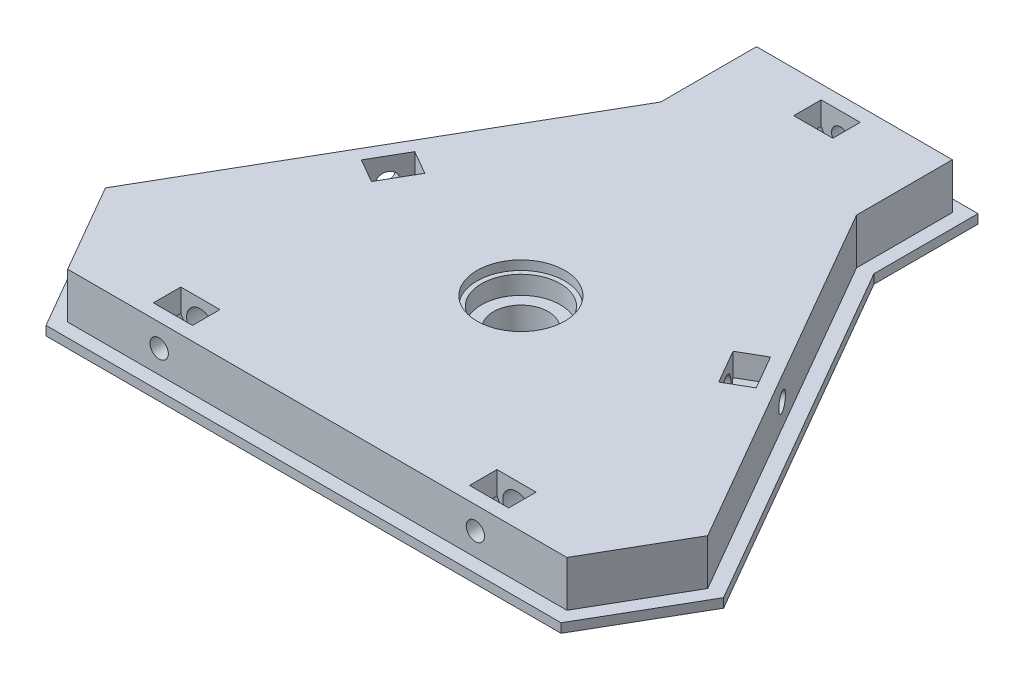
from build123d import *

# Parameters (mm, degrees)
SKETCH1_R           = 9.6
SKETCH1_R_2         = 8.6
SKETCH1_R_3         = 6
BOSS_EXTRUDE1_DEPTH = 12
BOSS_EXTRUDE2_DEPTH = 2
CUT_EXTRUDE1_START  = 12
SKETCH1_4_R         = 9.6
SKETCH1_4_R_2       = 8.6
CUT_EXTRUDE1_DEPTH  = 2
CUT_EXTRUDE2_START  = 12
SKETCH1_5_R         = 8.6
SKETCH1_5_R_2       = 6
CUT_EXTRUDE2_DEPTH  = 6
CUT_EXTRUDE3_START  = 12
SKETCH1_6_R         = 6
CUT_EXTRUDE3_DEPTH  = 116.166910647
SKETCH2_R           = 2
CUT_EXTRUDE4_DEPTH  = 3
CUT_EXTRUDE5_START  = -3
SKETCH2_4_R         = 3
SKETCH2_4_R_2       = 2
CUT_EXTRUDE5_DEPTH  = 6
CUT_EXTRUDE6_START  = -3
SKETCH2_5_R         = 3
SKETCH2_5_R_2       = 2
CUT_EXTRUDE6_DEPTH  = 16
SKETCH3_R           = 2
CUT_EXTRUDE7_DEPTH  = 3
CUT_EXTRUDE8_START  = 3
SKETCH3_7_R         = 3
SKETCH3_7_R_2       = 2
CUT_EXTRUDE8_DEPTH  = 6
CUT_EXTRUDE9_START  = 3
SKETCH3_8_R         = 3
SKETCH3_8_R_2       = 2
CUT_EXTRUDE9_DEPTH  = 16
SKETCH4_R           = 2
CUT_EXTRUDE10_DEPTH = 3
CUT_EXTRUDE11_START = -3
SKETCH4_3_R         = 3
SKETCH4_3_R_2       = 2
CUT_EXTRUDE11_DEPTH = 6
CUT_EXTRUDE12_START = -3
SKETCH4_4_R         = 3
SKETCH4_4_R_2       = 2
CUT_EXTRUDE12_DEPTH = 16
SKETCH5_R           = 2
CUT_EXTRUDE13_DEPTH = 3
CUT_EXTRUDE14_START = -3
SKETCH5_3_R         = 3
SKETCH5_3_R_2       = 2
CUT_EXTRUDE14_DEPTH = 6
CUT_EXTRUDE15_START = -3
SKETCH5_4_R         = 3
SKETCH5_4_R_2       = 2
CUT_EXTRUDE15_DEPTH = 16


with BuildPart() as part:
    # Sketch1 → Boss-Extrude1 (new body)
    # profile 1 of 7: a face of its own
    with BuildSketch(Plane(origin=(0, 0, 0), x_dir=(1, 0, 0), z_dir=(0, 1, 0))):
        Polygon((-65.817930688, -24.988893001), (-38.54293994, 22.25277675), (-11.267949192, 69.494446501), (11.267949192, 69.494446501), (38.54293994, 22.25277675), (65.817930688, -24.988893001), (54.549981495, -44.505553499), (0, -44.505553499), (-54.549981495, -44.505553499), align=None)
        Polygon((-52.817930688, -41.505553499), (-62.353829072, -24.988893001), (-35.944863729, 20.75277675), (-9.535898385, 66.494446501), (9.535898385, 66.494446501), (35.944863729, 20.75277675), (62.353829072, -24.988893001), (52.817930688, -41.505553499), (0, -41.505553499), align=None, mode=Mode.SUBTRACT)
    # profile 2 of 7: a face of its own
    with BuildSketch(Plane(origin=(0, 0, 0), x_dir=(1, 0, 0), z_dir=(0, 1, 0))):
        Polygon((-62.353829072, -24.988893001), (-35.944863729, 20.75277675), (-9.535898385, 66.494446501), (9.535898385, 66.494446501), (35.944863729, 20.75277675), (62.353829072, -24.988893001), (52.817930688, -41.505553499), (0, -41.505553499), (-52.817930688, -41.505553499), align=None)
        Circle(SKETCH1_R, mode=Mode.SUBTRACT)
    # profile 3 of 7: a face of its own
    with BuildSketch(Plane(origin=(0, 0, 0), x_dir=(1, 0, 0), z_dir=(0, 1, 0))):
        Polygon((13, 72.494446501), (-13, 72.494446501), (-21.4, 57.945219717), (-21.4, 51.945219717), (-11.267949192, 69.494446501), (11.267949192, 69.494446501), (21.4, 51.945219717), (21.4, 57.945219717), align=None)
    # profile 4 of 7: a face of its own
    with BuildSketch(Plane(origin=(0, 0, 0), x_dir=(1, 0, 0), z_dir=(0, 1, 0))):
        Polygon((-21.4, 57.945219717), (-13, 72.494446501), (13, 72.494446501), (21.4, 57.945219717), (21.4, 72.894446501), (-21.4, 72.894446501), align=None)
    # profile 5 of 7: a face of its own
    with BuildSketch(Plane(origin=(0, 0, 0), x_dir=(1, 0, 0), z_dir=(0, 1, 0))):
        Circle(SKETCH1_R)
        Circle(SKETCH1_R_2, mode=Mode.SUBTRACT)
    # profile 6 of 7: a face of its own
    with BuildSketch(Plane(origin=(0, 0, 0), x_dir=(1, 0, 0), z_dir=(0, 1, 0))):
        Circle(SKETCH1_R_2)
        Circle(SKETCH1_R_3, mode=Mode.SUBTRACT)
    # profile 7 of 7: a face of its own
    with BuildSketch(Plane(origin=(0, 0, 0), x_dir=(1, 0, 0), z_dir=(0, 1, 0))):
        Circle(SKETCH1_R_3)
    extrude(amount=BOSS_EXTRUDE1_DEPTH)

    # Sketch1<3> → Boss-Extrude2 (add)
    with BuildSketch(Plane(origin=(0, 0, 0), x_dir=(1, 0, 0), z_dir=(0, 1, 0))):
        Polygon((56.282032303, -47.505553499), (69.282032303, -24.988893001), (41.141016151, 23.75277675), (24.4, 52.749067294), (24.4, 75.494446501), (-24.4, 75.494446501), (-24.4, 52.749067294), (-41.141016151, 23.75277675), (-69.282032303, -24.988893001), (-56.282032303, -47.505553499), (0, -47.505553499), align=None)
        Polygon((-21.4, 51.945219717), (-21.4, 57.945219717), (-21.4, 72.894446501), (21.4, 72.894446501), (21.4, 57.945219717), (21.4, 51.945219717), (38.54293994, 22.25277675), (65.817930688, -24.988893001), (54.549981495, -44.505553499), (0, -44.505553499), (-54.549981495, -44.505553499), (-65.817930688, -24.988893001), (-38.54293994, 22.25277675), align=None, mode=Mode.SUBTRACT)
    extrude(amount=BOSS_EXTRUDE2_DEPTH)

    # Sketch1<4> → Cut-Extrude1 (cut)
    with BuildSketch(Plane(origin=(0, 0, 0), x_dir=(1, 0, 0), z_dir=(0, 1, 0)).offset(CUT_EXTRUDE1_START)):
        with Locations(Location((0, 0, 0), (0, 0, 270))):
            Circle(SKETCH1_4_R)
        with Locations(Location((0, 0, 0), (0, 0, 270))):
            Circle(SKETCH1_4_R_2, mode=Mode.SUBTRACT)
    extrude(amount=-CUT_EXTRUDE1_DEPTH, mode=Mode.SUBTRACT)

    # Sketch1<5> → Cut-Extrude2 (cut)
    with BuildSketch(Plane(origin=(0, 0, 0), x_dir=(1, 0, 0), z_dir=(0, 1, 0)).offset(CUT_EXTRUDE2_START)):
        with Locations(Location((0, 0, 0), (0, 0, 270))):
            Circle(SKETCH1_5_R)
        with Locations(Location((0, 0, 0), (0, 0, 270))):
            Circle(SKETCH1_5_R_2, mode=Mode.SUBTRACT)
    extrude(amount=-CUT_EXTRUDE2_DEPTH, mode=Mode.SUBTRACT)

    # Sketch1<6> → Cut-Extrude3 (cut, through all)
    with BuildSketch(Plane(origin=(0, 0, 0), x_dir=(1, 0, 0), z_dir=(0, 1, 0)).offset(CUT_EXTRUDE3_START)):
        with Locations(Location((0, 0, 0), (0, 0, 270))):
            Circle(SKETCH1_6_R)
    extrude(amount=-CUT_EXTRUDE3_DEPTH, mode=Mode.SUBTRACT)

    # Sketch2 → Cut-Extrude4 (cut)
    with BuildSketch(Plane.XY.offset(44.505553499)):
        with Locations((-34.549981495, 7)):
            Circle(SKETCH2_R)
        with Locations((34.549981495, 7)):
            Circle(SKETCH2_R)
    extrude(amount=-CUT_EXTRUDE4_DEPTH, mode=Mode.SUBTRACT)

    # Sketch2<4> → Cut-Extrude5 (cut)
    # profile 1 of 8: a face of its own
    with BuildSketch(Plane.XY.offset(44.505553499).offset(CUT_EXTRUDE5_START)):
        Polygon((-38.822373487, 12), (-38.822373487, 7), (-36.686177491, 10.7), (-32.413785499, 10.7), (-30.277589503, 7), (-30.277589503, 12), align=None)
    # profile 2 of 8: a face of its own
    with BuildSketch(Plane.XY.offset(44.505553499).offset(CUT_EXTRUDE5_START)):
        Polygon((-32.413785499, 10.7), (-36.686177491, 10.7), (-38.822373487, 7), (-36.686177491, 3.3), (-32.413785499, 3.3), (-30.277589503, 7), align=None)
        with Locations((-34.549981495, 7)):
            Circle(SKETCH2_4_R, mode=Mode.SUBTRACT)
    # profile 3 of 8: a face of its own
    with BuildSketch(Plane.XY.offset(44.505553499).offset(CUT_EXTRUDE5_START)):
        with Locations((-34.549981495, 7)):
            Circle(SKETCH2_4_R)
        with Locations((-34.549981495, 7)):
            Circle(SKETCH2_4_R_2, mode=Mode.SUBTRACT)
    # profile 4 of 8: a face of its own
    with BuildSketch(Plane.XY.offset(44.505553499).offset(CUT_EXTRUDE5_START)):
        with Locations((-34.549981495, 7)):
            Circle(SKETCH2_4_R_2)
    # profile 5 of 8: a face of its own
    with BuildSketch(Plane.XY.offset(44.505553499).offset(CUT_EXTRUDE5_START)):
        Polygon((38.822373487, 7), (36.686177491, 3.3), (32.413785499, 3.3), (30.277589503, 7), (32.413785499, 10.7), (36.686177491, 10.7), align=None)
        with Locations((34.549981495, 7)):
            Circle(SKETCH2_4_R, mode=Mode.SUBTRACT)
    # profile 6 of 8: a face of its own
    with BuildSketch(Plane.XY.offset(44.505553499).offset(CUT_EXTRUDE5_START)):
        with Locations((34.549981495, 7)):
            Circle(SKETCH2_4_R)
        with Locations((34.549981495, 7)):
            Circle(SKETCH2_4_R_2, mode=Mode.SUBTRACT)
    # profile 7 of 8: a face of its own
    with BuildSketch(Plane.XY.offset(44.505553499).offset(CUT_EXTRUDE5_START)):
        with Locations((34.549981495, 7)):
            Circle(SKETCH2_4_R_2)
    # profile 8 of 8: a face of its own
    with BuildSketch(Plane.XY.offset(44.505553499).offset(CUT_EXTRUDE5_START)):
        Polygon((38.822373487, 12), (30.277589503, 12), (30.277589503, 7), (32.413785499, 10.7), (36.686177491, 10.7), (38.822373487, 7), align=None)
    extrude(amount=-CUT_EXTRUDE5_DEPTH, mode=Mode.SUBTRACT)

    # Sketch2<5> → Cut-Extrude6 (cut)
    # profile 1 of 4: a face of its own
    with BuildSketch(Plane.XY.offset(44.505553499).offset(CUT_EXTRUDE6_START)):
        with Locations((-34.549981495, 7)):
            Circle(SKETCH2_5_R)
        with Locations((-34.549981495, 7)):
            Circle(SKETCH2_5_R_2, mode=Mode.SUBTRACT)
    # profile 2 of 4: a face of its own
    with BuildSketch(Plane.XY.offset(44.505553499).offset(CUT_EXTRUDE6_START)):
        with Locations((34.549981495, 7)):
            Circle(SKETCH2_5_R)
        with Locations((34.549981495, 7)):
            Circle(SKETCH2_5_R_2, mode=Mode.SUBTRACT)
    # profile 3 of 4: a face of its own
    with BuildSketch(Plane.XY.offset(44.505553499).offset(CUT_EXTRUDE6_START)):
        with Locations((-34.549981495, 7)):
            Circle(SKETCH2_5_R_2)
    # profile 4 of 4: a face of its own
    with BuildSketch(Plane.XY.offset(44.505553499).offset(CUT_EXTRUDE6_START)):
        with Locations((34.549981495, 7)):
            Circle(SKETCH2_5_R_2)
    extrude(amount=-CUT_EXTRUDE6_DEPTH, mode=Mode.SUBTRACT)

    # Sketch3 → Cut-Extrude7 (cut)
    with BuildSketch(Plane.XY.offset(-72.894446501)):
        with Locations(Location((0, 7, 0), (0, 0, 180))):
            Circle(SKETCH3_R)
    extrude(amount=CUT_EXTRUDE7_DEPTH, mode=Mode.SUBTRACT)

    # Sketch3<7> → Cut-Extrude8 (cut)
    # profile 1 of 4: a face of its own
    with BuildSketch(Plane.XY.offset(-72.894446501).offset(CUT_EXTRUDE8_START)):
        Polygon((2.136195996, 10.7), (4.272391992, 7), (4.272391992, 12), (-4.272391992, 12), (-4.272391992, 7), (-2.136195996, 10.7), align=None)
    # profile 2 of 4: a face of its own
    with BuildSketch(Plane.XY.offset(-72.894446501).offset(CUT_EXTRUDE8_START)):
        Polygon((2.136195996, 3.3), (4.272391992, 7), (2.136195996, 10.7), (-2.136195996, 10.7), (-4.272391992, 7), (-2.136195996, 3.3), align=None)
        with Locations((0, 7)):
            Circle(SKETCH3_7_R, mode=Mode.SUBTRACT)
    # profile 3 of 4: a face of its own
    with BuildSketch(Plane.XY.offset(-72.894446501).offset(CUT_EXTRUDE8_START)):
        with Locations((0, 7)):
            Circle(SKETCH3_7_R)
        with Locations(Location((0, 7, 0), (0, 0, 180))):
            Circle(SKETCH3_7_R_2, mode=Mode.SUBTRACT)
    # profile 4 of 4: a face of its own
    with BuildSketch(Plane.XY.offset(-72.894446501).offset(CUT_EXTRUDE8_START)):
        with Locations(Location((0, 7, 0), (0, 0, 180))):
            Circle(SKETCH3_7_R_2)
    extrude(amount=CUT_EXTRUDE8_DEPTH, mode=Mode.SUBTRACT)

    # Sketch3<8> → Cut-Extrude9 (cut)
    # profile 1 of 2: a face of its own
    with BuildSketch(Plane.XY.offset(-72.894446501).offset(CUT_EXTRUDE9_START)):
        with Locations((0, 7)):
            Circle(SKETCH3_8_R)
        with Locations(Location((0, 7, 0), (0, 0, 180))):
            Circle(SKETCH3_8_R_2, mode=Mode.SUBTRACT)
    # profile 2 of 2: a face of its own
    with BuildSketch(Plane.XY.offset(-72.894446501).offset(CUT_EXTRUDE9_START)):
        with Locations(Location((0, 7, 0), (0, 0, 180))):
            Circle(SKETCH3_8_R_2)
    extrude(amount=CUT_EXTRUDE9_DEPTH, mode=Mode.SUBTRACT)

    # Sketch4 → Cut-Extrude10 (cut)
    with BuildSketch(Plane(origin=(38.54293994, 0, -22.25277675), x_dir=(-0.5000000000000003, 0, -0.8660254037844386), z_dir=(0.8660254037844385, 0, -0.5000000000000002))):
        with Locations((-10.132050808, 7)):
            Circle(SKETCH4_R)
    extrude(amount=-CUT_EXTRUDE10_DEPTH, mode=Mode.SUBTRACT)

    # Sketch4<3> → Cut-Extrude11 (cut)
    # profile 1 of 4: a face of its own
    with BuildSketch(Plane(origin=(38.54293994, 0, -22.25277675), x_dir=(-0.5000000000000003, 0, -0.8660254037844386), z_dir=(0.8660254037844385, 0, -0.5000000000000002)).offset(CUT_EXTRUDE11_START)):
        Polygon((-14.4044428, 12), (-14.4044428, 7), (-12.268246804, 10.7), (-7.995854812, 10.7), (-5.859658816, 7), (-5.859658816, 12), align=None)
    # profile 2 of 4: a face of its own
    with BuildSketch(Plane(origin=(38.54293994, 0, -22.25277675), x_dir=(-0.5000000000000003, 0, -0.8660254037844386), z_dir=(0.8660254037844385, 0, -0.5000000000000002)).offset(CUT_EXTRUDE11_START)):
        Polygon((-7.995854812, 10.7), (-12.268246804, 10.7), (-14.4044428, 7), (-12.268246804, 3.3), (-7.995854812, 3.3), (-5.859658816, 7), align=None)
        with Locations((-10.132050808, 7)):
            Circle(SKETCH4_3_R, mode=Mode.SUBTRACT)
    # profile 3 of 4: a face of its own
    with BuildSketch(Plane(origin=(38.54293994, 0, -22.25277675), x_dir=(-0.5000000000000003, 0, -0.8660254037844386), z_dir=(0.8660254037844385, 0, -0.5000000000000002)).offset(CUT_EXTRUDE11_START)):
        with Locations((-10.132050808, 7)):
            Circle(SKETCH4_3_R)
        with Locations((-10.132050808, 7)):
            Circle(SKETCH4_3_R_2, mode=Mode.SUBTRACT)
    # profile 4 of 4: a face of its own
    with BuildSketch(Plane(origin=(38.54293994, 0, -22.25277675), x_dir=(-0.5000000000000003, 0, -0.8660254037844386), z_dir=(0.8660254037844385, 0, -0.5000000000000002)).offset(CUT_EXTRUDE11_START)):
        with Locations((-10.132050808, 7)):
            Circle(SKETCH4_3_R_2)
    extrude(amount=-CUT_EXTRUDE11_DEPTH, mode=Mode.SUBTRACT)

    # Sketch4<4> → Cut-Extrude12 (cut)
    # profile 1 of 2: a face of its own
    with BuildSketch(Plane(origin=(38.54293994, 0, -22.25277675), x_dir=(-0.5000000000000003, 0, -0.8660254037844386), z_dir=(0.8660254037844385, 0, -0.5000000000000002)).offset(CUT_EXTRUDE12_START)):
        with Locations((-10.132050808, 7)):
            Circle(SKETCH4_4_R)
        with Locations((-10.132050808, 7)):
            Circle(SKETCH4_4_R_2, mode=Mode.SUBTRACT)
    # profile 2 of 2: a face of its own
    with BuildSketch(Plane(origin=(38.54293994, 0, -22.25277675), x_dir=(-0.5000000000000003, 0, -0.8660254037844386), z_dir=(0.8660254037844385, 0, -0.5000000000000002)).offset(CUT_EXTRUDE12_START)):
        with Locations((-10.132050808, 7)):
            Circle(SKETCH4_4_R_2)
    extrude(amount=-CUT_EXTRUDE12_DEPTH, mode=Mode.SUBTRACT)

    # Sketch5 → Cut-Extrude13 (cut)
    with BuildSketch(Plane(origin=(-38.54293994, 0, -22.25277675), x_dir=(-0.4999999999999996, 0, 0.8660254037844389), z_dir=(-0.8660254037844389, 0, -0.4999999999999996))):
        with Locations((10.132050808, 7)):
            Circle(SKETCH5_R)
    extrude(amount=-CUT_EXTRUDE13_DEPTH, mode=Mode.SUBTRACT)

    # Sketch5<3> → Cut-Extrude14 (cut)
    # profile 1 of 4: a face of its own
    with BuildSketch(Plane(origin=(-38.54293994, 0, -22.25277675), x_dir=(-0.4999999999999996, 0, 0.8660254037844389), z_dir=(-0.8660254037844389, 0, -0.4999999999999996)).offset(CUT_EXTRUDE14_START)):
        Polygon((5.859658816, 12), (5.859658816, 7), (7.995854812, 10.7), (12.268246804, 10.7), (14.4044428, 7), (14.4044428, 12), align=None)
    # profile 2 of 4: a face of its own
    with BuildSketch(Plane(origin=(-38.54293994, 0, -22.25277675), x_dir=(-0.4999999999999996, 0, 0.8660254037844389), z_dir=(-0.8660254037844389, 0, -0.4999999999999996)).offset(CUT_EXTRUDE14_START)):
        Polygon((12.268246804, 10.7), (7.995854812, 10.7), (5.859658816, 7), (7.995854812, 3.3), (12.268246804, 3.3), (14.4044428, 7), align=None)
        with Locations((10.132050808, 7)):
            Circle(SKETCH5_3_R, mode=Mode.SUBTRACT)
    # profile 3 of 4: a face of its own
    with BuildSketch(Plane(origin=(-38.54293994, 0, -22.25277675), x_dir=(-0.4999999999999996, 0, 0.8660254037844389), z_dir=(-0.8660254037844389, 0, -0.4999999999999996)).offset(CUT_EXTRUDE14_START)):
        with Locations((10.132050808, 7)):
            Circle(SKETCH5_3_R)
        with Locations((10.132050808, 7)):
            Circle(SKETCH5_3_R_2, mode=Mode.SUBTRACT)
    # profile 4 of 4: a face of its own
    with BuildSketch(Plane(origin=(-38.54293994, 0, -22.25277675), x_dir=(-0.4999999999999996, 0, 0.8660254037844389), z_dir=(-0.8660254037844389, 0, -0.4999999999999996)).offset(CUT_EXTRUDE14_START)):
        with Locations((10.132050808, 7)):
            Circle(SKETCH5_3_R_2)
    extrude(amount=-CUT_EXTRUDE14_DEPTH, mode=Mode.SUBTRACT)

    # Sketch5<4> → Cut-Extrude15 (cut)
    # profile 1 of 2: a face of its own
    with BuildSketch(Plane(origin=(-38.54293994, 0, -22.25277675), x_dir=(-0.4999999999999996, 0, 0.8660254037844389), z_dir=(-0.8660254037844389, 0, -0.4999999999999996)).offset(CUT_EXTRUDE15_START)):
        with Locations((10.132050808, 7)):
            Circle(SKETCH5_4_R)
        with Locations((10.132050808, 7)):
            Circle(SKETCH5_4_R_2, mode=Mode.SUBTRACT)
    # profile 2 of 2: a face of its own
    with BuildSketch(Plane(origin=(-38.54293994, 0, -22.25277675), x_dir=(-0.4999999999999996, 0, 0.8660254037844389), z_dir=(-0.8660254037844389, 0, -0.4999999999999996)).offset(CUT_EXTRUDE15_START)):
        with Locations((10.132050808, 7)):
            Circle(SKETCH5_4_R_2)
    extrude(amount=-CUT_EXTRUDE15_DEPTH, mode=Mode.SUBTRACT)


solid = part.part
